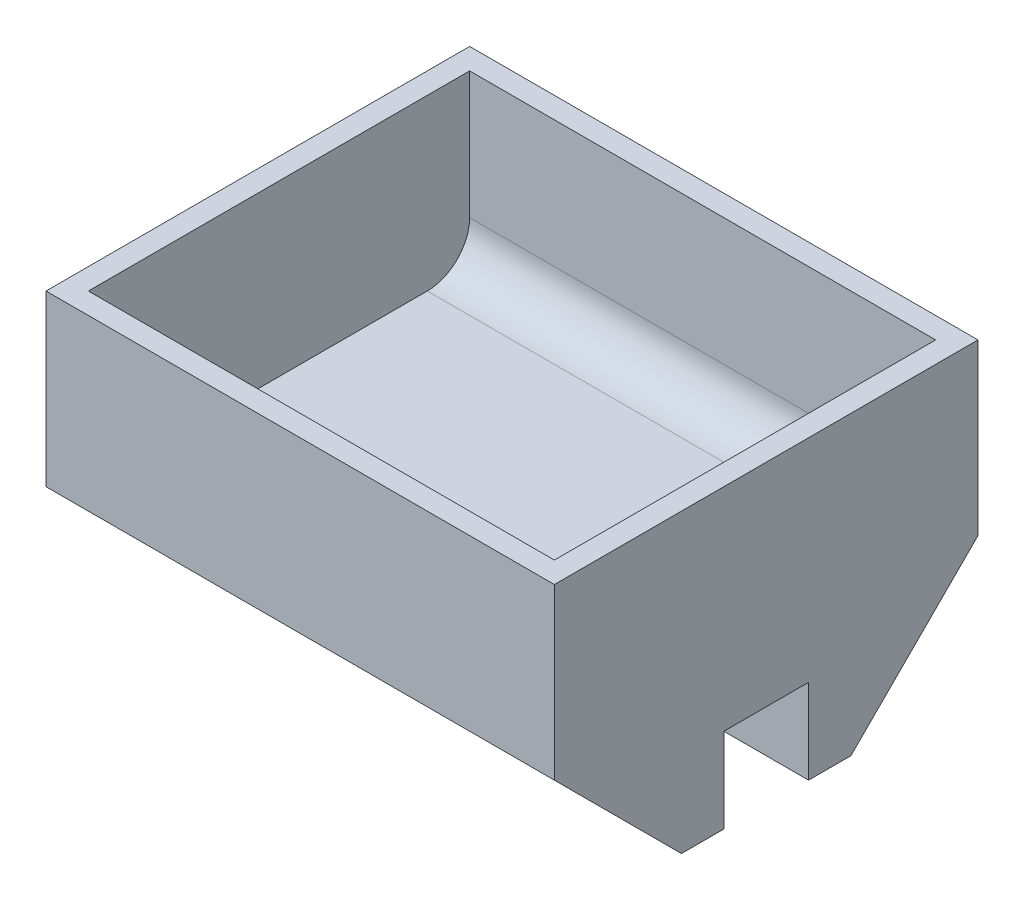
from build123d import *

# Parameters (mm, degrees)
SKETCH1_W               = 152.4
SKETCH1_H               = 38.1
BOSS_EXTRUDE1_DEPTH     = 50.8
SKETCH2_W               = 25.4
SKETCH2_H               = 25.4
CUT_EXTRUDE1_DEPTH      = 152.4
BOSS_EXTRUDE2_DEPTH     = 152.4
CUT_EXTRUDE3_DEPTH      = 129.420802443
CUT_EXTRUDE3_DEPTH_BACK = 129.420802443
SKETCH6_R               = 6.35
SKETCH10_R              = 6.35
SKETCH10_R_2            = 3.429
BOSS_EXTRUDE3_DEPTH     = 10.16
CUT_EXTRUDE4_DEPTH      = 69.85


with BuildPart() as part:
    # Sketch1 → Boss-Extrude1 (new body)
    with BuildSketch(Plane.XY):
        Rectangle(SKETCH1_W, SKETCH1_H)
    extrude(amount=BOSS_EXTRUDE1_DEPTH)

    # Sketch2 → Cut-Extrude1 (cut)
    with BuildSketch(Plane.ZY.offset(76.2)):
        with Locations((25.4, -6.35)):
            Rectangle(SKETCH2_W, SKETCH2_H)
    extrude(amount=-CUT_EXTRUDE1_DEPTH, mode=Mode.SUBTRACT)

    # Sketch5 → Boss-Extrude2 (add)
    with BuildSketch(Plane(origin=(76.2, 0, 0), x_dir=(0, 0, -1), z_dir=(1, 0, 0))):
        Polygon((0, -19.05), (38.1, 19.05), (38.1, 69.85), (-88.9, 69.85), (-88.9, 19.05), (-50.8, -19.05), (-50.8, 19.05), (0, 19.05), align=None)
    extrude(amount=-BOSS_EXTRUDE2_DEPTH)

    # Sketch6 → Cut-Extrude3 (cut, two sides: drawn at the far end of the back side and taken through both)
    with BuildSketch(Plane(origin=(0, 0, 38.1), x_dir=(-1, 0, 0), z_dir=(0, 0, -1)).offset(-CUT_EXTRUDE3_DEPTH_BACK)):
        with Locations(Location((0, -6.35, 0), (0, 0, 90))):
            Circle(SKETCH6_R)
        with Locations(Location((-50.8, -6.35, 0), (0, 0, 90))):
            Circle(SKETCH6_R)
        with Locations(Location((50.8, -6.35, 0), (0, 0, 90))):
            Circle(SKETCH6_R)
    extrude(amount=CUT_EXTRUDE3_DEPTH + CUT_EXTRUDE3_DEPTH_BACK, mode=Mode.SUBTRACT)

    # Sketch10 → Boss-Extrude3 (add)
    # profile 1 of 3: a face of its own
    with BuildSketch(Plane.XY.offset(12.7)):
        with Locations(Location((-50.8, -6.35, 0), (0, 0, 90))):
            Circle(SKETCH10_R)
        with Locations((-50.8, -6.35)):
            Circle(SKETCH10_R_2, mode=Mode.SUBTRACT)
    # profile 2 of 3: a face of its own
    with BuildSketch(Plane.XY.offset(12.7)):
        with Locations(Location((0, -6.35, 0), (0, 0, 90))):
            Circle(SKETCH10_R)
        with Locations((0, -6.35)):
            Circle(SKETCH10_R_2, mode=Mode.SUBTRACT)
    # profile 3 of 3: a face of its own
    with BuildSketch(Plane.XY.offset(12.7)):
        with Locations(Location((50.8, -6.35, 0), (0, 0, 90))):
            Circle(SKETCH10_R)
        with Locations((50.8, -6.35)):
            Circle(SKETCH10_R_2, mode=Mode.SUBTRACT)
    boss_extrude3 = extrude(amount=-BOSS_EXTRUDE3_DEPTH)

    # Sketch11 → Cut-Extrude4 (cut, symmetric)
    with BuildSketch(Plane(origin=(0, 0, 0), x_dir=(0, 0, -1), z_dir=(1, 0, 0))):
        with BuildLine():
            Line((-82.55, 69.85), (-82.55, 31.75))
            ThreePointArc((-82.55, 31.75), (-78.830256121, 22.769743879), (-69.85, 19.05))
            Line((-69.85, 19.05), (19.05, 19.05))
            ThreePointArc((19.05, 19.05), (28.030256121, 22.769743879), (31.75, 31.75))
            Line((31.75, 31.75), (31.75, 69.85))
            Line((31.75, 69.85), (-82.55, 69.85))
        make_face()
    extrude(amount=CUT_EXTRUDE4_DEPTH, both=True, mode=Mode.SUBTRACT)

    # Mirror1: Boss-Extrude3 across plane
    add(boss_extrude3.mirror(Plane.XY.offset(25.4)))


solid = part.part
